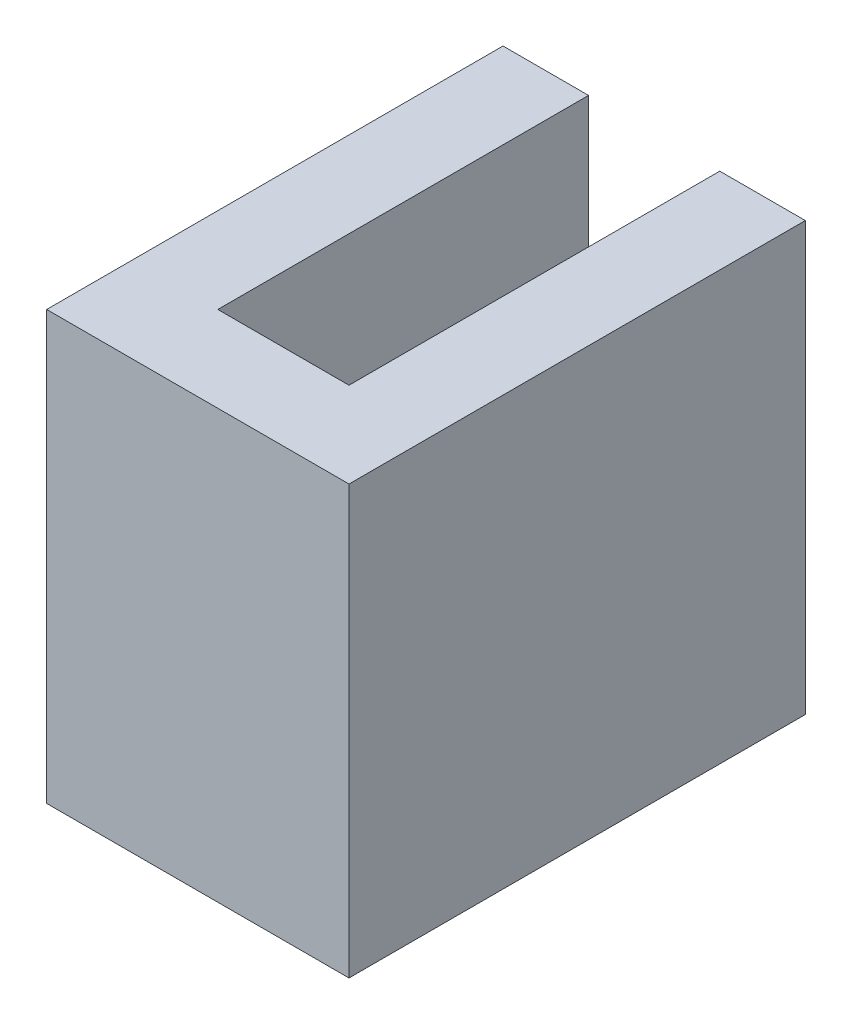
from build123d import *

# Parameters (mm, degrees)
BOSS_EXTRUDE1_DEPTH = 15


with BuildPart() as part:
    # Sketch1 → Boss-Extrude1 (new body)
    with BuildSketch(Plane(origin=(0, 0, 0), x_dir=(1, 0, 0), z_dir=(0, 1, 0))):
        Polygon((0, 0), (0, 16), (3, 16), (3, 3), (7.6, 3), (7.6, 16), (10.6, 16), (10.6, 0), align=None)
    extrude(amount=BOSS_EXTRUDE1_DEPTH)


solid = part.part
